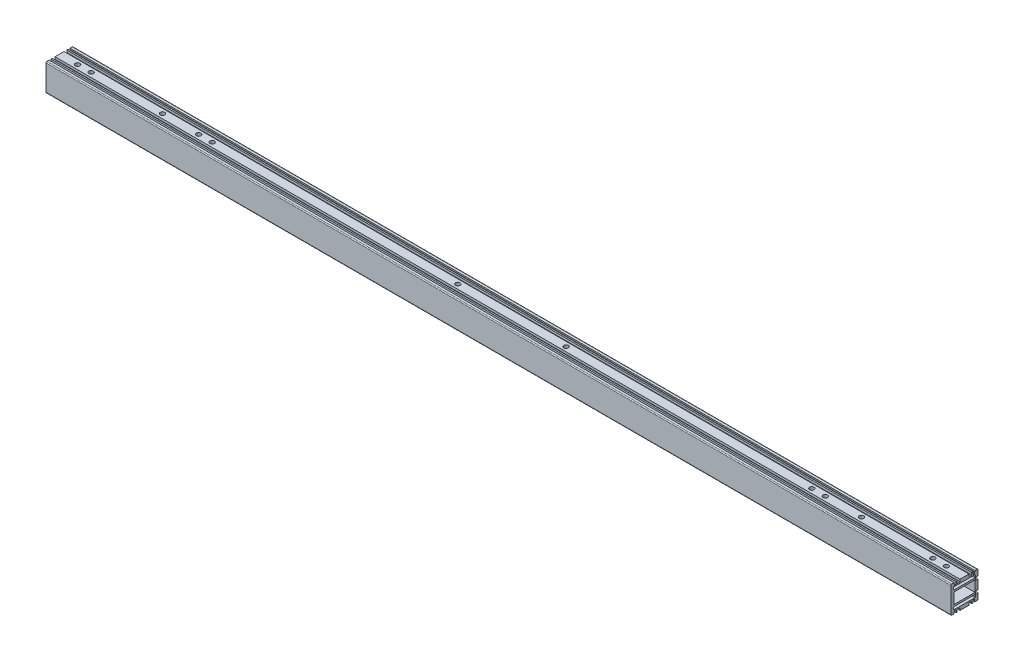
from build123d import *

# Parameters (mm, degrees)
SKETCH_1_W             = 23.5
SKETCH_1_H             = 12
EXTRUDE_1_DEPTH        = 501
HOLE_WIZARD_M6_1_D     = 5
HOLE_WIZARD_M6_1_DEPTH = 15
HOLE_WIZARD_M6_1_TIP   = 1.502151548
HOLE_WIZARD_M6_2_D     = 5
HOLE_WIZARD_M6_2_DEPTH = 15
HOLE_WIZARD_M6_2_TIP   = 1.502151548
HOLE_WIZARD_M6_3_D     = 5
HOLE_WIZARD_M6_3_DEPTH = 15
HOLE_WIZARD_M6_3_TIP   = 1.502151548


with BuildPart() as part:
    # 草图1 → 凸台-拉伸1 (new, symmetric)
    with BuildSketch(Plane(origin=(0, 0, 0), x_dir=(0, 0, -1), z_dir=(1, 0, 0))):
        with BuildLine():
            Line((-11.5, 15), (-14, 15))
            ThreePointArc((-14, 15), (-14.707106781, 14.707106781), (-15, 14))
            Line((-15, 14), (-15, -14))
            ThreePointArc((-15, -14), (-14.707106781, -14.707106781), (-14, -15))
            Line((-14, -15), (-11.5, -15))
            Line((-11.5, -15), (-11.5, -13.5))
            Line((-11.5, -13.5), (-11.4, -13.5))
            ThreePointArc((-11.4, -13.5), (-11.117157288, -13.382842712), (-11, -13.1))
            Line((-11, -13.1), (-11, -12))
            Line((-11, -12), (-9.5, -12))
            Line((-9.5, -12), (-9.5, -15))
            Line((-9.5, -15), (-8, -15))
            Line((-8, -15), (-8, -12.5))
            Line((-8, -12.5), (-5, -12.5))
            Line((-5, -12.5), (-5, -15))
            Line((-5, -15), (5, -15))
            Line((5, -15), (5, -12.5))
            Line((5, -12.5), (8, -12.5))
            Line((8, -12.5), (8, -15))
            Line((8, -15), (9.5, -15))
            Line((9.5, -15), (9.5, -12))
            Line((9.5, -12), (11, -12))
            Line((11, -12), (11, -13.1))
            ThreePointArc((11, -13.1), (11.117157288, -13.382842712), (11.4, -13.5))
            Line((11.4, -13.5), (11.5, -13.5))
            Line((11.5, -13.5), (11.5, -15))
            Line((11.5, -15), (14, -15))
            ThreePointArc((14, -15), (14.707106781, -14.707106781), (15, -14))
            Line((15, -14), (15, -8))
            Line((15, -8), (12.5, -8))
            Line((12.5, -8), (12.5, -5))
            Line((12.5, -5), (15, -5))
            Line((15, -5), (15, 5))
            Line((15, 5), (12.5, 5))
            Line((12.5, 5), (12.5, 8))
            Line((12.5, 8), (15, 8))
            Line((15, 8), (15, 14))
            ThreePointArc((15, 14), (14.707106781, 14.707106781), (14, 15))
            Line((14, 15), (11.5, 15))
            Line((11.5, 15), (11.5, 13.5))
            Line((11.5, 13.5), (11.4, 13.5))
            ThreePointArc((11.4, 13.5), (11.117157288, 13.382842712), (11, 13.1))
            Line((11, 13.1), (11, 12))
            Line((11, 12), (9.5, 12))
            Line((9.5, 12), (9.5, 15))
            Line((9.5, 15), (8, 15))
            Line((8, 15), (8, 12.5))
            Line((8, 12.5), (5, 12.5))
            Line((5, 12.5), (5, 15))
            Line((5, 15), (-5, 15))
            Line((-5, 15), (-5, 12.5))
            Line((-5, 12.5), (-8, 12.5))
            Line((-8, 12.5), (-8, 15))
            Line((-8, 15), (-9.5, 15))
            Line((-9.5, 15), (-9.5, 12))
            Line((-9.5, 12), (-11, 12))
            Line((-11, 12), (-11, 13.1))
            ThreePointArc((-11, 13.1), (-11.117157288, 13.382842712), (-11.4, 13.5))
            Line((-11.4, 13.5), (-11.5, 13.5))
            Line((-11.5, 13.5), (-11.5, 15))
        make_face()
        with BuildLine():
            Line((12, -8.5), (12, -10.5))
            ThreePointArc((12, -10.5), (11.853553391, -10.853553391), (11.5, -11))
            Line((11.5, -11), (-11.5, -11))
            ThreePointArc((-11.5, -11), (-11.853553391, -10.853553391), (-12, -10.5))
            Line((-12, -10.5), (-12, -8.5))
            ThreePointArc((-12, -8.5), (-11.853553391, -8.146446609), (-11.5, -8))
            Line((-11.5, -8), (11.5, -8))
            ThreePointArc((11.5, -8), (11.853553391, -8.146446609), (12, -8.5))
        make_face(mode=Mode.SUBTRACT)
        Rectangle(SKETCH_1_W, SKETCH_1_H, mode=Mode.SUBTRACT)
        with BuildLine():
            ThreePointArc((-12, 10.5), (-11.853553391, 10.853553391), (-11.5, 11))
            Line((-11.5, 11), (11.5, 11))
            ThreePointArc((11.5, 11), (11.853553391, 10.853553391), (12, 10.5))
            Line((12, 10.5), (12, 8.5))
            ThreePointArc((12, 8.5), (11.853553391, 8.146446609), (11.5, 8))
            Line((11.5, 8), (-11.5, 8))
            ThreePointArc((-11.5, 8), (-11.853553391, 8.146446609), (-12, 8.5))
            Line((-12, 8.5), (-12, 10.5))
        make_face(mode=Mode.SUBTRACT)
    extrude(amount=EXTRUDE_1_DEPTH, both=True)

    # M6 螺纹孔1
    with Locations(Plane.XZ.offset(15)):
        with Locations((-481, 0), (-466, 0), (466, 0), (481, 0)):
            Hole(HOLE_WIZARD_M6_1_D / 2, depth=HOLE_WIZARD_M6_1_DEPTH)
            with Locations((0, 0, -(HOLE_WIZARD_M6_1_DEPTH + HOLE_WIZARD_M6_1_TIP / 2))):  # 118° drill point
                Cone(0, HOLE_WIZARD_M6_1_D / 2, HOLE_WIZARD_M6_1_TIP, mode=Mode.SUBTRACT)

    # M6 螺纹孔2
    with Locations(Plane(origin=(0, 15, 0), x_dir=(-1, 0, 0), z_dir=(0, 1, 0))):
        with Locations((-481, 0), (-466, 0), (466, 0), (481, 0)):
            Hole(HOLE_WIZARD_M6_2_D / 2, depth=HOLE_WIZARD_M6_2_DEPTH)
            with Locations((0, 0, -(HOLE_WIZARD_M6_2_DEPTH + HOLE_WIZARD_M6_2_TIP / 2))):  # 118° drill point
                Cone(0, HOLE_WIZARD_M6_2_D / 2, HOLE_WIZARD_M6_2_TIP, mode=Mode.SUBTRACT)

    # M6 螺纹孔3
    with Locations(Plane(origin=(0, 15, 0), x_dir=(-1, 0, 0), z_dir=(0, 1, 0))):
        with Locations((387, 0), (347, 0), (60, 0), (-60, 0), (-347, 0), (-387, 0), (332, 0), (-332, 0)):
            Hole(HOLE_WIZARD_M6_3_D / 2, depth=HOLE_WIZARD_M6_3_DEPTH)
            with Locations((0, 0, -(HOLE_WIZARD_M6_3_DEPTH + HOLE_WIZARD_M6_3_TIP / 2))):  # 118° drill point
                Cone(0, HOLE_WIZARD_M6_3_D / 2, HOLE_WIZARD_M6_3_TIP, mode=Mode.SUBTRACT)


solid = part.part
